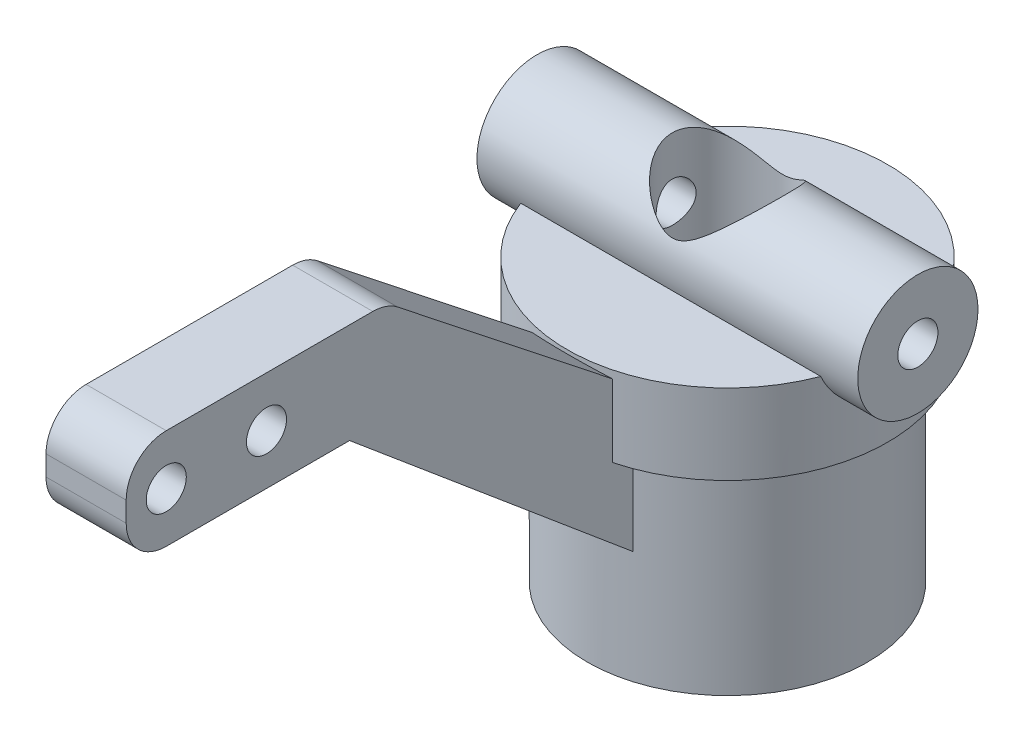
from build123d import *

# Parameters (mm, degrees)
SKETCH_1_R                   = 7
EXTRUDE_1_DEPTH              = 10
SKETCH_2_R                   = 8
EXTRUDE_2_DEPTH              = 4
SKETCH_3_R                   = 3
EXTRUDE_3_DEPTH              = 9.5
CUT_EXTRUDE_1_DEPTH          = 28.367864531
CUT_EXTRUDE_1_DEPTH_BACK     = 28.367864531
SKETCH_4_R                   = 1
SKETCH_8_R                   = 1
EXTRUDE_4_DEPTH              = 2
HOLE_WIZARD_M5_1_D           = 5.5
HOLE_WIZARD_M5_1_CBORE_D     = 11
HOLE_WIZARD_M5_1_CBORE_DEPTH = 6.5
FILLET_1_R                   = 2


with BuildPart() as part:
    # 草图1 → 凸台-拉伸1 (new body)
    with BuildSketch(Plane(origin=(0, 0, 0), x_dir=(1, 0, 0), z_dir=(0, 1, 0))):
        with Locations(Location((0, 0, 0), (0, 0, 270))):
            Circle(SKETCH_1_R)
    extrude(amount=EXTRUDE_1_DEPTH)

    # 草图2 → 凸台-拉伸2 (add)
    with BuildSketch(Plane(origin=(0, 10, 0), x_dir=(1, 0, 0), z_dir=(0, 1, 0))):
        with Locations(Location((0, 0, 0), (0, 0, 270))):
            Circle(SKETCH_2_R)
    extrude(amount=EXTRUDE_2_DEPTH)

    # 草图3 → 凸台-拉伸3 (add, symmetric)
    with BuildSketch(Plane(origin=(0, 0, 0), x_dir=(0, 0, -1), z_dir=(1, 0, 0))):
        with Locations((0, 15)):
            Circle(SKETCH_3_R)
    extrude(amount=EXTRUDE_3_DEPTH, both=True)

    # 草图4 → 切除-拉伸1 (cut, two sides: drawn at the far end of the back side and taken through both)
    with BuildSketch(Plane(origin=(9.5, 0, 0), x_dir=(0, 0, -1), z_dir=(1, 0, 0)).offset(-CUT_EXTRUDE_1_DEPTH_BACK)):
        with Locations((0, 15)):
            Circle(SKETCH_4_R)
    extrude(amount=CUT_EXTRUDE_1_DEPTH + CUT_EXTRUDE_1_DEPTH_BACK, mode=Mode.SUBTRACT)

    # 草图8 → 凸台-拉伸4 (add, symmetric)
    with BuildSketch(Plane(origin=(0, 0, 0), x_dir=(0, 0, -1), z_dir=(1, 0, 0))):
        Polygon((0, 0), (-20.85568787, 17.5), (-32, 17.5), (-32, 22.5), (-19, 22.5), (0, 7.5), align=None)
        with Locations((-30, 20)):
            Circle(SKETCH_8_R, mode=Mode.SUBTRACT)
        with Locations((-25, 20)):
            Circle(SKETCH_8_R, mode=Mode.SUBTRACT)
    extrude(amount=EXTRUDE_4_DEPTH, both=True)

    # M5 六角头螺栓的柱形沉头孔1 (through all)
    with Locations(Plane(origin=(0, 0, 0), x_dir=(-1, 0, 0), z_dir=(0, -1, 0))):
        with Locations((0, 0)):
            CounterBoreHole(HOLE_WIZARD_M5_1_D / 2, HOLE_WIZARD_M5_1_CBORE_D / 2, HOLE_WIZARD_M5_1_CBORE_DEPTH)

    # 圆角1
    fillet_1_edges = [part.edges().sort_by_distance(p)[0] for p in [
        (0, 22.5, 19),
        (0, 22.5, 32),
        (0, 17.5, 32),
    ]]
    fillet(fillet_1_edges, radius=FILLET_1_R)


solid = part.part
